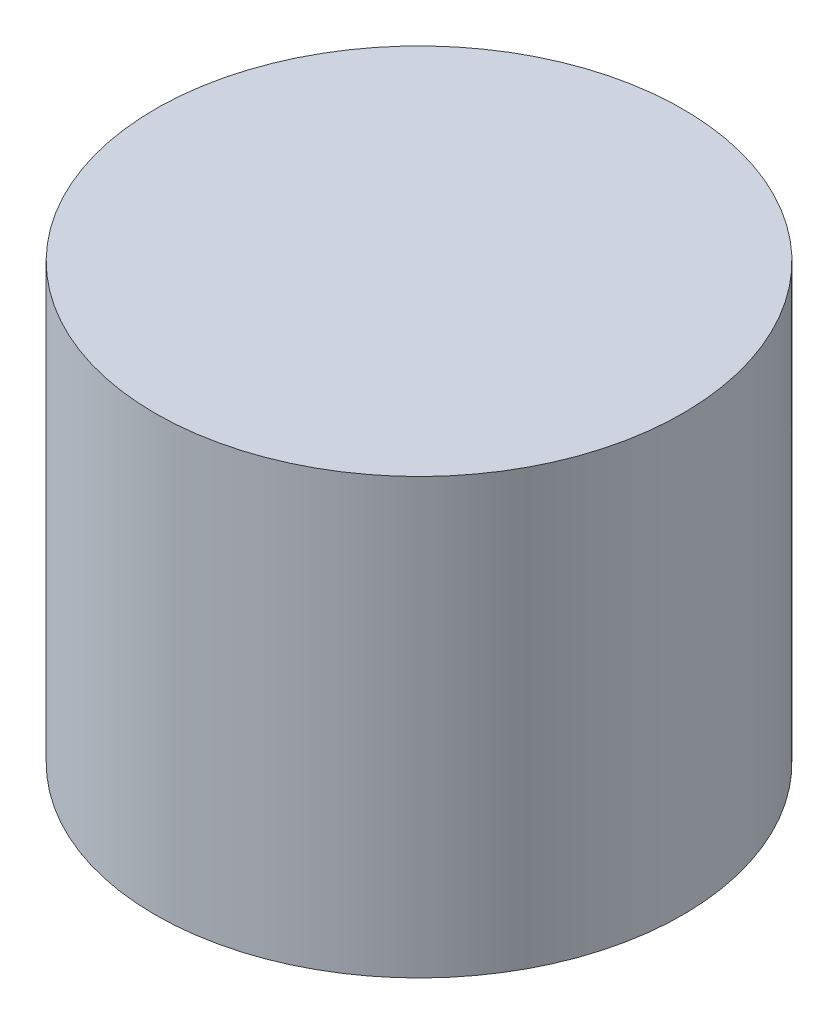
from build123d import *

# Parameters (mm, degrees)
BOSS_EXTRUDE1_DEPTH      = 1.4
BOSS_EXTRUDE1_DEPTH_BACK = 1.4
SKETCH1_R                = 1.7


with BuildPart() as part:
    # Sketch1 → Boss-Extrude1 (new, two sides: drawn at the far end of the back side and taken through both)
    with BuildSketch(Plane(origin=(0, 0, 0), x_dir=(1, 0, 0), z_dir=(0, 1, 0)).offset(-BOSS_EXTRUDE1_DEPTH_BACK)):
        Circle(SKETCH1_R)
    extrude(amount=BOSS_EXTRUDE1_DEPTH + BOSS_EXTRUDE1_DEPTH_BACK)


solid = part.part
